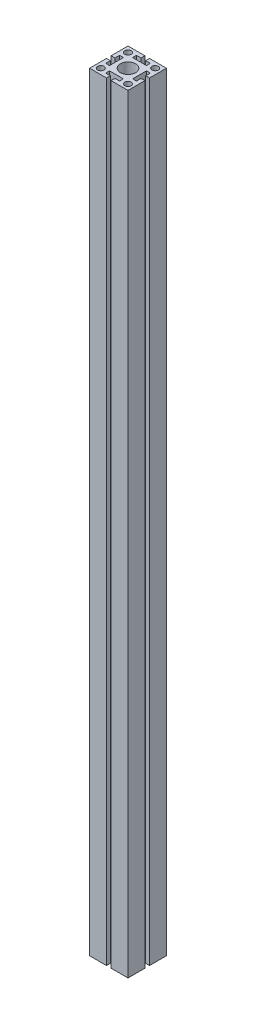
from build123d import *

# Parameters (mm, degrees)
SKETCH1_R           = 10
SKETCH1_R_2         = 4.138691164
BOSS_EXTRUDE1_DEPTH = 1000


with BuildPart() as part:
    # Sketch1 → Boss-Extrude1 (new body)
    with BuildSketch(Plane(origin=(0, 0, 0), x_dir=(1, 0, 0), z_dir=(0, 1, 0))):
        Polygon((-25, -3), (-25, -25), (-3, -25), (-3, -20), (-9, -20), (-9, -15), (9, -15), (9, -20), (3, -20), (3, -25), (25, -25), (25, -3), (20, -3), (20, -9), (15, -9), (15, 9), (20, 9), (20, 3), (25, 3), (25, 25), (3, 25), (3, 20), (9, 20), (9, 15), (-9, 15), (-9, 20), (-3, 20), (-3, 25), (-25, 25), (-25, 3), (-20, 3), (-20, 9), (-15, 9), (-15, -9), (-20, -9), (-20, -3), align=None)
        with Locations(Location((0, 0, 0), (0, 0, 270))):
            Circle(SKETCH1_R, mode=Mode.SUBTRACT)
        with Locations(Location((-17.67766953, 17.67766953, 0), (0, 0, 270))):
            Circle(SKETCH1_R_2, mode=Mode.SUBTRACT)
        with Locations(Location((17.67766953, 17.67766953, 0), (0, 0, 270))):
            Circle(SKETCH1_R_2, mode=Mode.SUBTRACT)
        with Locations(Location((17.67766953, -17.67766953, 0), (0, 0, 270))):
            Circle(SKETCH1_R_2, mode=Mode.SUBTRACT)
        with Locations(Location((-17.67766953, -17.67766953, 0), (0, 0, 270))):
            Circle(SKETCH1_R_2, mode=Mode.SUBTRACT)
    extrude(amount=BOSS_EXTRUDE1_DEPTH)


solid = part.part
